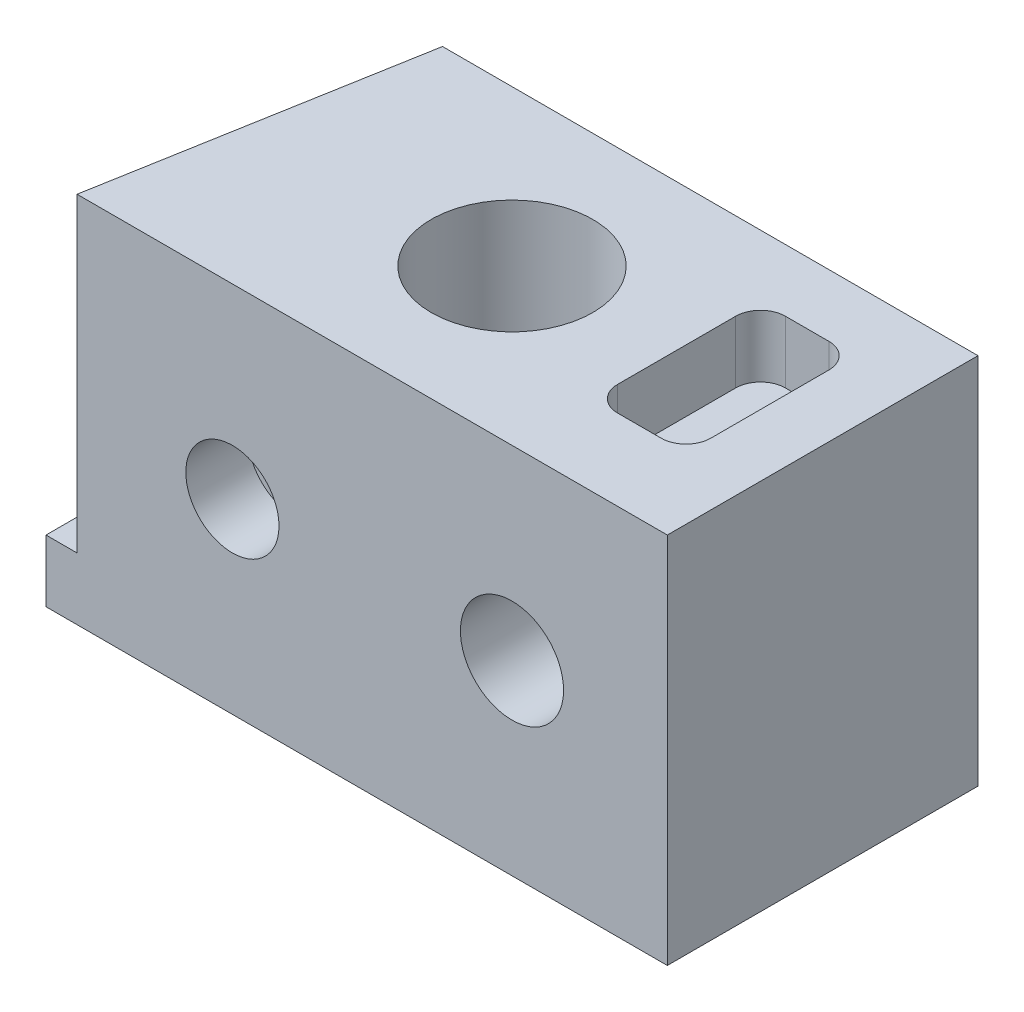
from build123d import *

# Parameters (mm, degrees)
SKETCH1_W           = 100
SKETCH1_H           = 50
BOSS_EXTRUDE1_DEPTH = 60
CUT_EXTRUDE1_DEPTH  = 50
SKETCH3_R           = 13
CUT_EXTRUDE2_DEPTH  = 50
SKETCH4_R           = 8.30196488
CUT_EXTRUDE3_DEPTH  = 93.736184955
CUT_EXTRUDE4_DEPTH  = 10
SKETCH7_R           = 7.5
CUT_EXTRUDE5_DEPTH  = 10


with BuildPart() as part:
    # Sketch1 → Boss-Extrude1 (new body)
    with BuildSketch(Plane(origin=(0, 0, 0), x_dir=(1, 0, 0), z_dir=(0, 1, 0))):
        Rectangle(SKETCH1_W, SKETCH1_H)
    extrude(amount=BOSS_EXTRUDE1_DEPTH)

    # Sketch2 → Cut-Extrude1 (cut)
    with BuildSketch(Plane(origin=(0, 60, 0), x_dir=(1, 0, 0), z_dir=(0, 1, 0))):
        Polygon((-50, 25), (-36.183650965, 25), (-45, -25), (-50, -25), align=None)
    extrude(amount=-CUT_EXTRUDE1_DEPTH, mode=Mode.SUBTRACT)

    # Sketch3 → Cut-Extrude2 (cut)
    with BuildSketch(Plane(origin=(0, 60, 0), x_dir=(1, 0, 0), z_dir=(0, 1, 0))):
        with Locations(Location((0, 0, 0), (0, 0, 270))):
            Circle(SKETCH3_R)
    extrude(amount=-CUT_EXTRUDE2_DEPTH, mode=Mode.SUBTRACT)

    # Sketch4 → Cut-Extrude3 (cut, through all)
    with BuildSketch(Plane.XY.offset(25)):
        with Locations((25, 30)):
            Circle(SKETCH4_R)
    extrude(amount=-CUT_EXTRUDE3_DEPTH, mode=Mode.SUBTRACT)

    # Sketch6 → Cut-Extrude4 (cut)
    with BuildSketch(Plane(origin=(0, 60, 0), x_dir=(1, 0, 0), z_dir=(0, 1, 0))):
        with BuildLine():
            Line((29, 15), (36, 15))
            ThreePointArc((36, 15), (38.828427125, 13.828427125), (40, 11))
            Line((40, 11), (40, -8))
            ThreePointArc((40, -8), (38.828427125, -10.828427125), (36, -12))
            Line((36, -12), (29, -12))
            ThreePointArc((29, -12), (26.171572875, -10.828427125), (25, -8))
            Line((25, -8), (25, 11))
            ThreePointArc((25, 11), (26.171572875, 13.828427125), (29, 15))
        make_face()
    extrude(amount=-CUT_EXTRUDE4_DEPTH, mode=Mode.SUBTRACT)

    # Sketch7 → Cut-Extrude5 (cut)
    with BuildSketch(Plane.XY.offset(25)):
        with Locations((-20, 30)):
            Circle(SKETCH7_R)
    extrude(amount=-CUT_EXTRUDE5_DEPTH, mode=Mode.SUBTRACT)


solid = part.part
